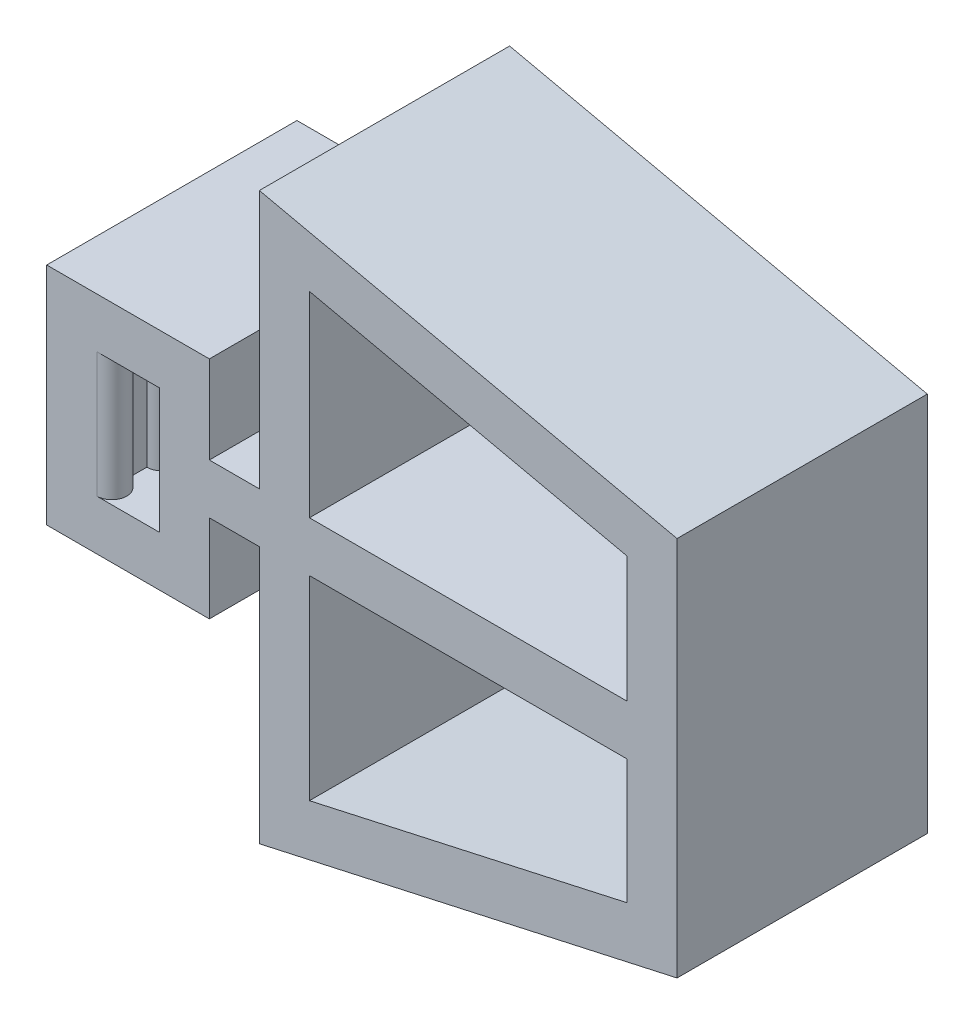
from build123d import *

# Parameters (mm, degrees)
SKETCH1_W           = 2.5
SKETCH1_H           = 5
SKETCH1_W_2         = 12.691848092
SKETCH1_H_2         = 2
BOSS_EXTRUDE1_DEPTH = 10
BOSS_EXTRUDE2_DEPTH = 5
LPATTERN1_COUNT     = 5
LPATTERN1_PITCH     = 2


with BuildPart() as part:
    # Sketch1 → Boss-Extrude1 (new body)
    # profile 1 of 3: a face of its own
    with BuildSketch(Plane.XY):
        Polygon((49.805812864, -41.856488388), (49.805812864, -39.856488388), (47.805812864, -39.856488388), (47.805812864, -36.356488388), (41.305812864, -36.356488388), (41.305812864, -45.356488388), (47.805812864, -45.356488388), (47.805812864, -41.856488388), align=None)
        with Locations((44.555812864, -40.856488388)):
            Rectangle(SKETCH1_W, SKETCH1_H, mode=Mode.SUBTRACT)
    # profile 2 of 3: a face of its own
    with BuildSketch(Plane.XY):
        Polygon((66.497660956, -33.227883866), (49.805812864, -29.527390234), (49.805812864, -39.856488388), (49.805812864, -41.856488388), (49.805812864, -52.138716904), (66.497660956, -48.438223273), align=None)
        Polygon((51.805812864, -41.856488388), (51.805812864, -39.856488388), (51.805812864, -32.019338588), (64.497660956, -34.833053569), (64.497660956, -39.856488388), (64.497660956, -41.856488388), (64.497660956, -46.833053569), (51.805812864, -49.64676855), align=None, mode=Mode.SUBTRACT)
    # profile 3 of 3: a face of its own
    with BuildSketch(Plane.XY):
        with Locations((58.15173691, -40.856488388)):
            Rectangle(SKETCH1_W_2, SKETCH1_H_2)
    extrude(amount=BOSS_EXTRUDE1_DEPTH)

    # Sketch2 → Boss-Extrude2 (add)
    with BuildSketch(Plane.XZ.offset(38.356488388)):
        with BuildLine():
            Line((43.305812864, 8.8), (43.305812864, 10))
            ThreePointArc((43.305812864, 10), (43.905812864, 9.4), (43.305812864, 8.8))
        make_face()
    boss_extrude2 = extrude(amount=BOSS_EXTRUDE2_DEPTH)

    # LPattern1: Boss-Extrude2 ×5
    with Locations(*[(0, 0, -i * LPATTERN1_PITCH) for i in range(1, LPATTERN1_COUNT)]):
        add(boss_extrude2)


solid = part.part
